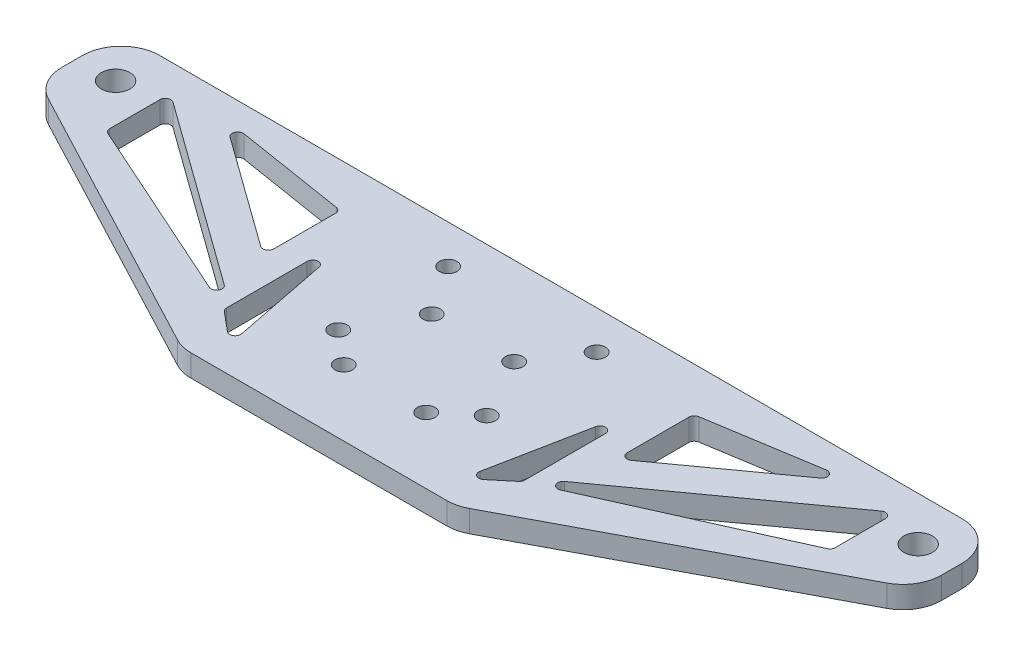
from build123d import *

# Parameters (mm, degrees)
EXTRUDE_1_DEPTH     = 4
SKETCH_2_R          = 1.6
CUT_EXTRUDE_1_DEPTH = 92.38927727
SKETCH_3_R          = 2.6
SKETCH_3_R_2        = 1.6
CUT_EXTRUDE_2_DEPTH = 92.38927727
FILLET_1_R          = 7


with BuildPart() as part:
    # 草图1 → 凸台-拉伸1 (new body)
    with BuildSketch(Plane(origin=(0, 0, 0), x_dir=(1, 0, 0), z_dir=(0, 1, 0))):
        Polygon((25, 0), (-25, 0), (-80, 29), (-80, 44), (80, 44), (80, 29), align=None)
    extrude(amount=EXTRUDE_1_DEPTH)

    # 草图2 → 切除-拉伸1 (cut, through all)
    with BuildSketch(Plane(origin=(0, 4, 0), x_dir=(1, 0, 0), z_dir=(0, 1, 0))):
        with Locations(Location((-7.5, 28, 0), (0, 0, 270))):
            Circle(SKETCH_2_R)
        with Locations(Location((7.5, 28, 0), (0, 0, 90))):
            Circle(SKETCH_2_R)
        with Locations(Location((-7.5, 12, 0), (0, 0, 90))):
            Circle(SKETCH_2_R)
        with Locations(Location((7.5, 12, 0), (0, 0, 270))):
            Circle(SKETCH_2_R)
    extrude(amount=-CUT_EXTRUDE_1_DEPTH, mode=Mode.SUBTRACT)

    # 草图3 → 切除-拉伸2 (cut, through all)
    with BuildSketch(Plane(origin=(0, 4, 0), x_dir=(1, 0, 0), z_dir=(0, 1, 0))):
        with Locations(Location((-73, 36, 0), (0, 0, 270))):
            Circle(SKETCH_3_R)
        with Locations(Location((73, 36, 0), (0, 0, 90))):
            Circle(SKETCH_3_R)
        with Locations(Location((-13.5, 17, 0), (0, 0, 270))):
            Circle(SKETCH_3_R_2)
        with Locations(Location((-13.5, 37, 0), (0, 0, 270))):
            Circle(SKETCH_3_R_2)
        with Locations(Location((13.5, 17, 0), (0, 0, 90))):
            Circle(SKETCH_3_R_2)
        with Locations(Location((13.5, 37, 0), (0, 0, 90))):
            Circle(SKETCH_3_R_2)
        with BuildLine():
            Line((-66, 37.045901786), (-66, 27.918180848))
            ThreePointArc((-66, 27.918180848), (-65.839389964, 27.374651191), (-65.409151024, 27.005714169))
            Line((-65.409151024, 27.005714169), (-31.946763962, 12.00114442))
            ThreePointArc((-31.946763962, 12.00114442), (-30.671368472, 12.413990718), (-30.952679882, 13.724692673))
            Line((-30.952679882, 13.724692673), (-64.415066944, 37.85698336))
            ThreePointArc((-64.415066944, 37.85698336), (-65.455558418, 37.936107677), (-66, 37.045901786))
        make_face()
        with BuildLine():
            Line((-53.712306987, 37.53593293), (-33.713971886, 23.113601522))
            ThreePointArc((-33.713971886, 23.113601522), (-32.673480412, 23.034477205), (-32.12903883, 23.924683096))
            Line((-32.12903883, 23.924683096), (-32.12903883, 35.147280888))
            ThreePointArc((-32.12903883, 35.147280888), (-32.368121456, 35.796129676), (-32.971048329, 36.13472152))
            Line((-32.971048329, 36.13472152), (-52.96938343, 39.334455136))
            ThreePointArc((-52.96938343, 39.334455136), (-54.051625259, 38.728799106), (-53.712306987, 37.53593293))
        make_face()
        with BuildLine():
            Line((-21.676324022, 7.610054966), (-25.148014353, 25.176303846))
            ThreePointArc((-25.148014353, 25.176303846), (-26.22644397, 25.97766474), (-27.12903883, 24.982419926))
            Line((-27.12903883, 24.982419926), (-27.12903883, 10.309246321))
            ThreePointArc((-27.12903883, 10.309246321), (-27.034628251, 9.885090925), (-26.76922323, 9.541025042))
            Line((-26.76922323, 9.541025042), (-23.2975329, 6.647949766))
            ThreePointArc((-23.2975329, 6.647949766), (-22.147000978, 6.556202787), (-21.676324022, 7.610054966))
        make_face()
        with BuildLine():
            Line((26.76922323, 9.541025042), (23.2975329, 6.647949766))
            ThreePointArc((23.2975329, 6.647949766), (22.147000978, 6.556202787), (21.676324022, 7.610054966))
            Line((21.676324022, 7.610054966), (25.148014353, 25.176303846))
            ThreePointArc((25.148014353, 25.176303846), (26.22644397, 25.97766474), (27.12903883, 24.982419926))
            Line((27.12903883, 24.982419926), (27.12903883, 10.309246321))
            ThreePointArc((27.12903883, 10.309246321), (27.034628251, 9.885090925), (26.76922323, 9.541025042))
        make_face()
        with BuildLine():
            Line((32.971048329, 36.13472152), (52.96938343, 39.334455136))
            ThreePointArc((52.96938343, 39.334455136), (54.051625259, 38.728799106), (53.712306987, 37.53593293))
            Line((53.712306987, 37.53593293), (33.713971886, 23.113601522))
            ThreePointArc((33.713971886, 23.113601522), (32.673480412, 23.034477205), (32.12903883, 23.924683096))
            Line((32.12903883, 23.924683096), (32.12903883, 35.147280888))
            ThreePointArc((32.12903883, 35.147280888), (32.368121456, 35.796129676), (32.971048329, 36.13472152))
        make_face()
        with BuildLine():
            Line((30.952679882, 13.724692673), (64.415066944, 37.85698336))
            ThreePointArc((64.415066944, 37.85698336), (65.455558418, 37.936107677), (66, 37.045901786))
            Line((66, 37.045901786), (66, 27.918180848))
            ThreePointArc((66, 27.918180848), (65.839389964, 27.374651191), (65.409151024, 27.005714169))
            Line((65.409151024, 27.005714169), (31.946763962, 12.00114442))
            ThreePointArc((31.946763962, 12.00114442), (30.671368472, 12.413990718), (30.952679882, 13.724692673))
        make_face()
    extrude(amount=-CUT_EXTRUDE_2_DEPTH, mode=Mode.SUBTRACT)

    # 圆角1
    fillet_1_edges = [part.edges().sort_by_distance(p)[0] for p in [
        (-80, 2, -29),
        (-80, 2, -44),
        (80, 2, -44),
        (80, 2, -29),
        (25, 2, 0),
        (-25, 2, 0),
    ]]
    fillet(fillet_1_edges, radius=FILLET_1_R)


solid = part.part
